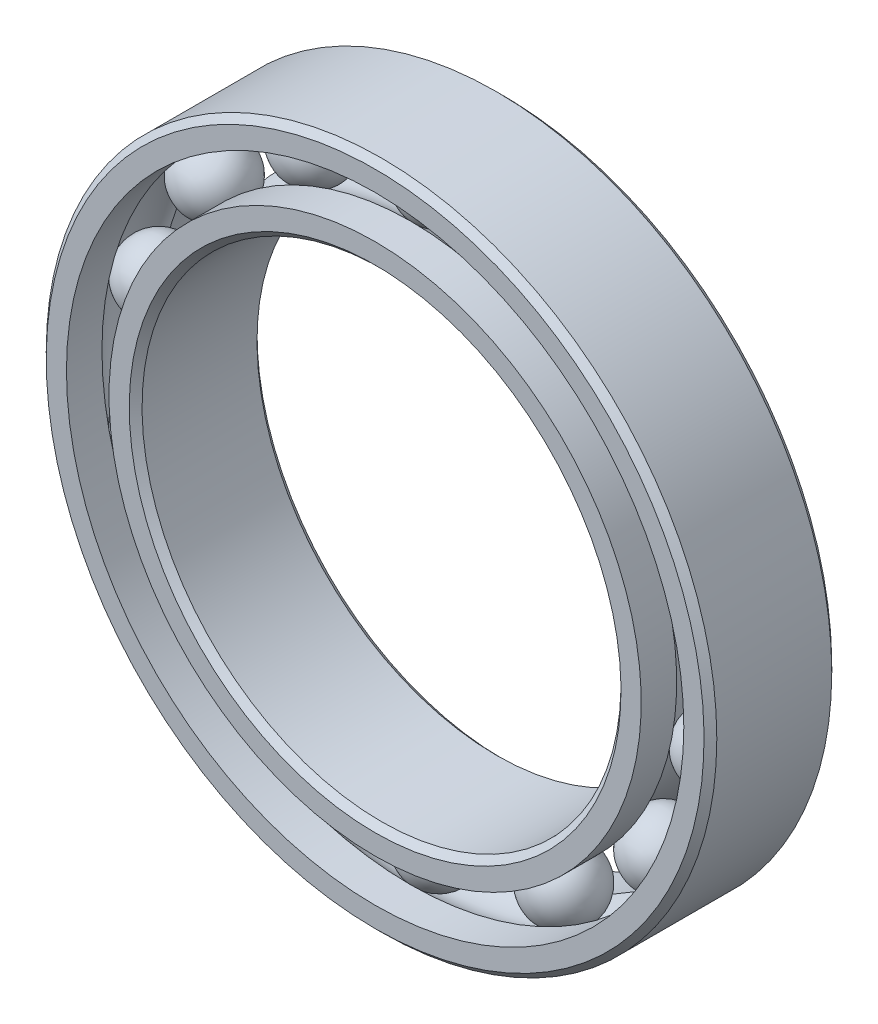
from build123d import *

# Parameters (mm, degrees)
CIRPATTERN1_COUNT = 14


with BuildPart() as part:
    # Sketch6 → Revolve5 (revolve)
    with BuildSketch(Plane(origin=(0, 0, 0), x_dir=(0, 0, -1), z_dir=(1, 0, 0)), mode=Mode.PRIVATE) as revolve5_sk:
        with BuildLine():
            Line((1.8, 10.5), (2, 10.3))
            Line((2, 10.3), (2, 9.666666667))
            Line((2, 9.666666667), (0.888888889, 9.666666667))
            ThreePointArc((0.888888889, 9.666666667), (0, 10.111111111), (-0.888888889, 9.666666667))
            Line((-0.888888889, 9.666666667), (-2, 9.666666667))
            Line((-2, 9.666666667), (-2, 10.3))
            Line((-2, 10.3), (-1.8, 10.5))
            Line((-1.8, 10.5), (1.8, 10.5))
        make_face()
    revolve(revolve5_sk.sketch.rotate(Axis((0, 0, 2), (0, 0, -1)), 180), axis=Axis((0, 0, 2), (0, 0, -1)))


with BuildPart() as body_2:
    # Sketch3 → Revolve3 (revolve)
    with BuildSketch(Plane(origin=(0, 0, 0), x_dir=(0, 0, -1), z_dir=(1, 0, 0)), mode=Mode.PRIVATE) as revolve3_sk:
        with BuildLine():
            Line((-2, 8.333333333), (-0.888888889, 8.333333333))
            ThreePointArc((-0.888888889, 8.333333333), (0, 7.888888889), (0.888888889, 8.333333333))
            Line((0.888888889, 8.333333333), (2, 8.333333333))
            Line((2, 8.333333333), (2, 7.7))
            Line((2, 7.7), (1.8, 7.5))
            Line((1.8, 7.5), (-1.8, 7.5))
            Line((-1.8, 7.5), (-2, 7.7))
            Line((-2, 7.7), (-2, 8.333333333))
        make_face()
    revolve(revolve3_sk.sketch.rotate(Axis((0, 0, 2), (0, 0, -1)), 180), axis=Axis((0, 0, 2), (0, 0, -1)))


with BuildPart() as body_3:
    # Sketch4 → Revolve4 (revolve)
    with BuildSketch(Plane(origin=(0, 0, 0), x_dir=(0, 0, -1), z_dir=(1, 0, 0))):
        with BuildLine():
            Line((-1.111111111, 9), (1.111111111, 9))
            ThreePointArc((1.111111111, 9), (0, 10.111111111), (-1.111111111, 9))
        make_face()
    revolve(axis=Axis((0, 9, 1.111111111), (0, 0, -1)))


with BuildPart() as cirpattern1_1:
    # CirPattern1: pattern copy
    add(body_3.part.rotate(Axis((0, 0, 0), (0, 0, 1)), 1 * 360 / CIRPATTERN1_COUNT))


with BuildPart() as cirpattern1_2:
    # CirPattern1: pattern copy
    add(body_3.part.rotate(Axis((0, 0, 0), (0, 0, 1)), 2 * 360 / CIRPATTERN1_COUNT))


with BuildPart() as cirpattern1_3:
    # CirPattern1: pattern copy
    add(body_3.part.rotate(Axis((0, 0, 0), (0, 0, 1)), 3 * 360 / CIRPATTERN1_COUNT))


with BuildPart() as cirpattern1_4:
    # CirPattern1: pattern copy
    add(body_3.part.rotate(Axis((0, 0, 0), (0, 0, 1)), 4 * 360 / CIRPATTERN1_COUNT))


with BuildPart() as cirpattern1_5:
    # CirPattern1: pattern copy
    add(body_3.part.rotate(Axis((0, 0, 0), (0, 0, 1)), 5 * 360 / CIRPATTERN1_COUNT))


with BuildPart() as cirpattern1_6:
    # CirPattern1: pattern copy
    add(body_3.part.rotate(Axis((0, 0, 0), (0, 0, 1)), 6 * 360 / CIRPATTERN1_COUNT))


with BuildPart() as cirpattern1_7:
    # CirPattern1: pattern copy
    add(body_3.part.rotate(Axis((0, 0, 0), (0, 0, 1)), 7 * 360 / CIRPATTERN1_COUNT))


with BuildPart() as cirpattern1_8:
    # CirPattern1: pattern copy
    add(body_3.part.rotate(Axis((0, 0, 0), (0, 0, 1)), 8 * 360 / CIRPATTERN1_COUNT))


with BuildPart() as cirpattern1_9:
    # CirPattern1: pattern copy
    add(body_3.part.rotate(Axis((0, 0, 0), (0, 0, 1)), 9 * 360 / CIRPATTERN1_COUNT))


with BuildPart() as cirpattern1_10:
    # CirPattern1: pattern copy
    add(body_3.part.rotate(Axis((0, 0, 0), (0, 0, 1)), 10 * 360 / CIRPATTERN1_COUNT))


with BuildPart() as cirpattern1_11:
    # CirPattern1: pattern copy
    add(body_3.part.rotate(Axis((0, 0, 0), (0, 0, 1)), 11 * 360 / CIRPATTERN1_COUNT))


with BuildPart() as cirpattern1_12:
    # CirPattern1: pattern copy
    add(body_3.part.rotate(Axis((0, 0, 0), (0, 0, 1)), 12 * 360 / CIRPATTERN1_COUNT))


with BuildPart() as cirpattern1_13:
    # CirPattern1: pattern copy
    add(body_3.part.rotate(Axis((0, 0, 0), (0, 0, 1)), 13 * 360 / CIRPATTERN1_COUNT))


solid = Compound([part.part, body_2.part, body_3.part, cirpattern1_1.part, cirpattern1_2.part, cirpattern1_3.part, cirpattern1_4.part, cirpattern1_5.part, cirpattern1_6.part, cirpattern1_7.part, cirpattern1_8.part, cirpattern1_9.part, cirpattern1_10.part, cirpattern1_11.part, cirpattern1_12.part, cirpattern1_13.part])
